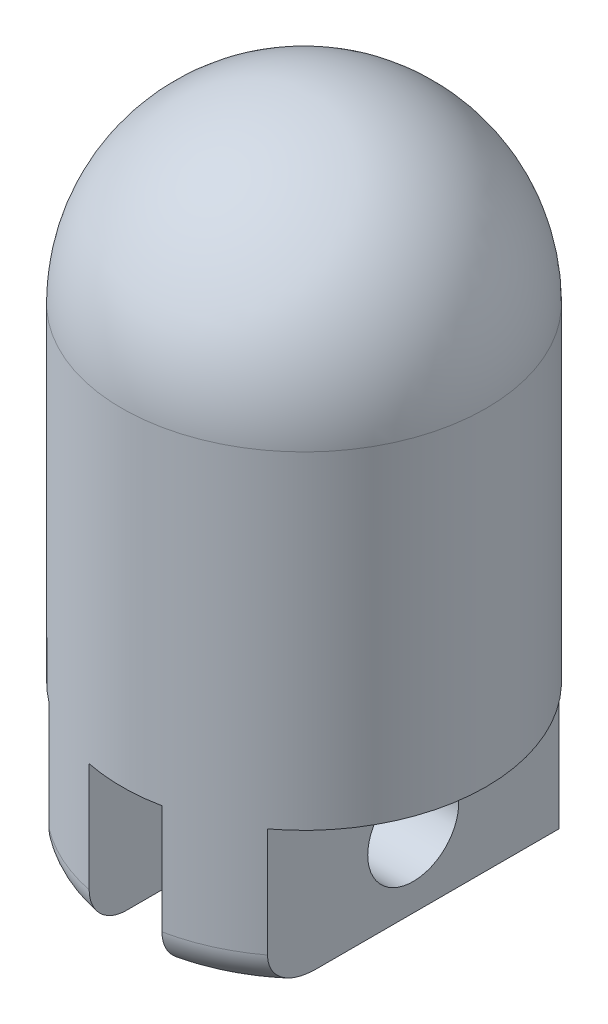
from build123d import *

# Parameters (mm, degrees)
CUT_EXTRUDE1_DEPTH = 10.16
SKETCH3_R          = 3.175
CUT_EXTRUDE2_DEPTH = 52.61889964
FILLET1_R          = 2.54


with BuildPart() as part:
    # Sketch1 → Revolve1 (revolve)
    with BuildSketch(Plane.XY, mode=Mode.PRIVATE) as revolve1_sk:
        with BuildLine():
            Line((0, 0), (0, 5.602635041))
            Line((0, 5.602635041), (-2.54, 5.602635041))
            Line((-2.54, 5.602635041), (-2.54, 22.86))
            ThreePointArc((-2.54, 22.86), (-10.394222266, 34.299587235), (0, 43.492688289))
            Line((0, 43.492688289), (0, 45.72))
            ThreePointArc((0, 45.72), (-8.980256121, 42.000256121), (-12.7, 33.02))
            Line((-12.7, 33.02), (-12.7, 0))
            Line((-12.7, 0), (0, 0))
        make_face()
    revolve(revolve1_sk.sketch.rotate(Axis((0, 0, 0), (0, 1, 0)), 270), axis=Axis((0, 0, 0), (0, 1, 0)))

    # Sketch2 → Cut-Extrude1 (cut)
    with BuildSketch(Plane.XZ):
        with BuildLine():
            Line((-2.54, 12.443407893), (-2.54, -12.443407893))
            ThreePointArc((-2.54, -12.443407893), (0, -12.7), (2.54, -12.443407893))
            Line((2.54, -12.443407893), (2.54, 12.443407893))
            ThreePointArc((2.54, 12.443407893), (0, 12.7), (-2.54, 12.443407893))
        make_face()
        with BuildLine():
            Line((-7.62, 10.16), (-7.62, -10.16))
            ThreePointArc((-7.62, -10.16), (-12.7, 0), (-7.62, 10.16))
        make_face()
        with BuildLine():
            Line((7.62, 10.16), (7.62, -10.16))
            ThreePointArc((7.62, -10.16), (12.7, 0), (7.62, 10.16))
        make_face()
    extrude(amount=-CUT_EXTRUDE1_DEPTH, mode=Mode.SUBTRACT)

    # Sketch3 → Cut-Extrude2 (cut, through all)
    with BuildSketch(Plane.ZY.offset(7.62)):
        with Locations((0, 5.08)):
            Circle(SKETCH3_R)
    extrude(amount=-CUT_EXTRUDE2_DEPTH, mode=Mode.SUBTRACT)

    # Fillet1
    fillet1_edges = [part.edges().sort_by_distance(p)[0] for p in [
        (5.206715654, 0, 11.583613948),
        (-5.206715654, 0, 11.583613948),
    ]]
    fillet(fillet1_edges, radius=FILLET1_R)


solid = part.part
